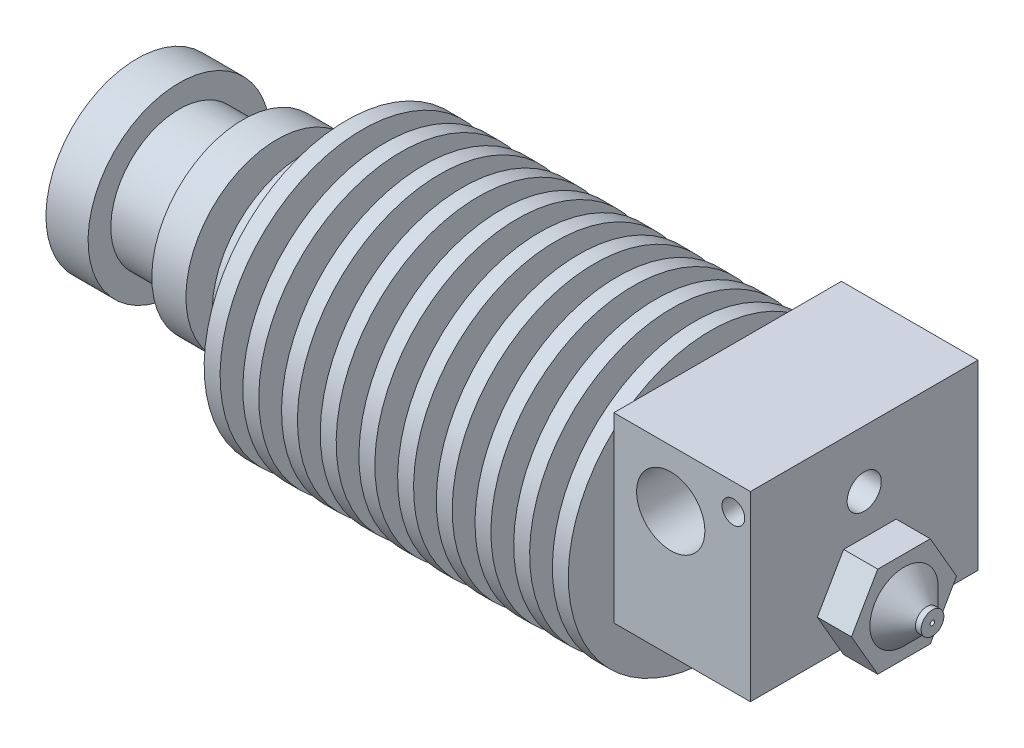
from build123d import *

# Parameters (mm, degrees)
BOSS_EXTRUDE1_DEPTH = 3
BOSS_EXTRUDE2_START = -10
SKETCH3_W           = 12
SKETCH3_H           = 16
SKETCH3_R           = 3
SKETCH3_R_2         = 1
BOSS_EXTRUDE2_DEPTH = 20
SKETCH4_R           = 1.5
CUT_EXTRUDE5_DEPTH  = 12
CUT_EXTRUDE6_START  = -13.5
SKETCH5_R           = 1
CUT_EXTRUDE6_DEPTH  = 18.2


with BuildPart() as part:
    # Sketch1 → Revolve1 (revolve)
    with BuildSketch(Plane.XY, mode=Mode.PRIVATE) as revolve1_sk:
        Polygon((0, 8), (3.7, 8), (3.7, 6), (9.3, 6), (9.3, 8), (12.3, 8), (12.3, 3.75), (14.6, 3.75), (14.6, 8), (16.6, 8), (16.6, 3.75), (18.4, 3.75), (18.4, 12.5), (19.8, 12.5), (19.8, 3.75), (21.8, 3.75), (21.8, 12.5), (23.2, 12.5), (23.2, 3.75), (25.2, 3.75), (25.2, 12.5), (26.6, 12.5), (26.6, 3.75), (28.6, 3.75), (28.6, 12.5), (30, 12.5), (30, 3.75), (32, 3.75), (32, 12.5), (33.4, 12.5), (33.4, 3.75), (35.4, 3.75), (35.4, 12.5), (36.8, 12.5), (36.8, 3.75), (38.8, 3.75), (38.8, 12.5), (40.2, 12.5), (40.2, 3.75), (42.2, 3.75), (42.2, 12.5), (43.6, 12.5), (43.6, 3.75), (45.6, 3.75), (45.6, 12.5), (47, 12.5), (47, 3.75), (49, 3.75), (49, 12.5), (50.4, 12.5), (50.4, 3), (64.4, 3), (64.4, 4), (67.4, 4), (67.4, 3), (69.4, 1), (69.9, 1), (69.9, 0.2), (69.4, 0.2), (68.6, 1), (11.75, 1), (8, 4.75), (0, 4.75), align=None)
    revolve(revolve1_sk.sketch.rotate(Axis((0, 0, 0), (1, 0, 0)), 180), axis=Axis((0, 0, 0), (1, 0, 0)))

    # Sketch2 → Boss-Extrude1 (add)
    with BuildSketch(Plane.ZY.offset(-64.4)):
        Polygon((2.309401077, 4), (-2.309401077, 4), (-4.618802154, 0), (-2.309401077, -4), (2.309401077, -4), (4.618802154, 0), align=None)
    extrude(amount=-BOSS_EXTRUDE1_DEPTH)

    # Sketch3 → Boss-Extrude2 (add)
    with BuildSketch(Plane.XY.offset(BOSS_EXTRUDE2_START)):
        with Locations((57.9, 4)):
            Rectangle(SKETCH3_W, SKETCH3_H)
        with Locations((56.9, 7)):
            Circle(SKETCH3_R, mode=Mode.SUBTRACT)
        with Locations((62.4, 9.7)):
            Circle(SKETCH3_R_2, mode=Mode.SUBTRACT)
    extrude(amount=BOSS_EXTRUDE2_DEPTH)

    # Sketch4 → Cut-Extrude5 (cut)
    with BuildSketch(Plane(origin=(63.9, 0, 0), x_dir=(0, 0, -1), z_dir=(1, 0, 0))):
        with Locations((0, 7)):
            Circle(SKETCH4_R)
    extrude(amount=-CUT_EXTRUDE5_DEPTH, mode=Mode.SUBTRACT)

    # Sketch5 → Cut-Extrude6 (cut)
    with BuildSketch(Plane(origin=(63.9, 0, 0), x_dir=(0, 0, -1), z_dir=(1, 0, 0)).offset(CUT_EXTRUDE6_START)):
        with Locations(Location((0, 0, 0), (0, 0, 270))):
            Circle(SKETCH5_R)
    extrude(amount=CUT_EXTRUDE6_DEPTH, mode=Mode.SUBTRACT)


solid = part.part
